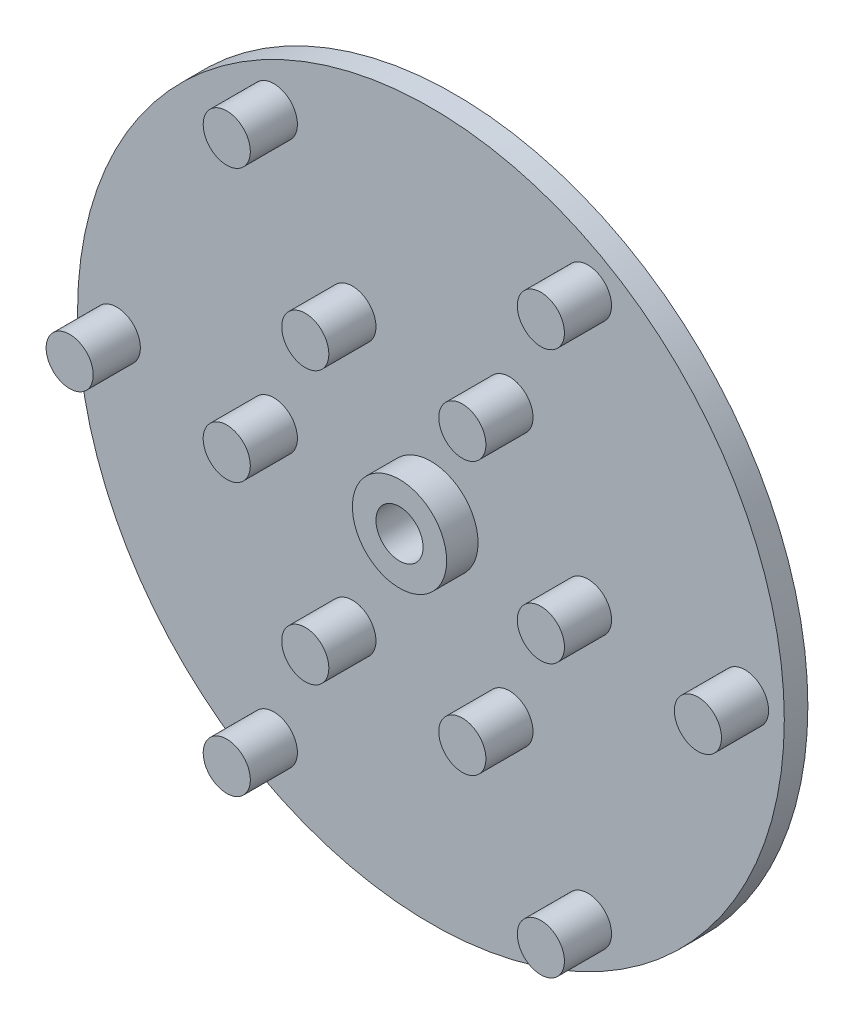
from build123d import *

# Parameters (mm, degrees)
SKETCH_1_R           = 45
EXTRUDE_1_DEPTH      = 3
SKETCH_2_R           = 3
EXTRUDE_2_DEPTH      = 6
EXTRUDE_3_DEPTH      = 4
EXTRUDE_3_DEPTH_BACK = 5
SKETCH_3_R           = 6
CUT_EXTRUDE_1_REACH  = 66.273
SKETCH_4_R           = 3
SKETCH_5_R           = 3
EXTRUDE_4_DEPTH      = 6


with BuildPart() as part:
    # 草图1 → 凸台-拉伸1 (new body)
    with BuildSketch(Plane.XY):
        Circle(SKETCH_1_R)
    extrude(amount=-EXTRUDE_1_DEPTH)

    # 草图2 → 凸台-拉伸2 (add)
    with BuildSketch(Plane.XY):
        with Locations(Location((-40, 0, 0), (0, 0, 180))):
            Circle(SKETCH_2_R)
        with Locations(Location((-20, 34.641016151, 0), (0, 0, 180))):
            Circle(SKETCH_2_R)
        with Locations(Location((20, 34.641016151, 0), (0, 0, 180))):
            Circle(SKETCH_2_R)
        with Locations(Location((40, 0, 0), (0, 0, 180))):
            Circle(SKETCH_2_R)
        with Locations(Location((20, -34.641016151, 0), (0, 0, 180))):
            Circle(SKETCH_2_R)
        with Locations(Location((-20, -34.641016151, 0), (0, 0, 180))):
            Circle(SKETCH_2_R)
    extrude(amount=EXTRUDE_2_DEPTH)

    # 草图3 → 凸台-拉伸3 (add, two sides: drawn at the far end of the back side and taken through both)
    with BuildSketch(Plane.XY.offset(-EXTRUDE_3_DEPTH_BACK)):
        Circle(SKETCH_3_R)
    extrude(amount=EXTRUDE_3_DEPTH + EXTRUDE_3_DEPTH_BACK)

    # 草图4 → 切除-拉伸1 (cut, up to next)
    with BuildSketch(Plane.XY.offset(4), mode=Mode.PRIVATE) as cut_extrude_1_sk1:
        Circle(SKETCH_4_R)
    cut_extrude_1_tool1 = extrude(cut_extrude_1_sk1.sketch, amount=-CUT_EXTRUDE_1_REACH, mode=Mode.PRIVATE) & part.part
    add(cut_extrude_1_tool1.solids().sort_by_distance((0, 0, 4))[0], mode=Mode.SUBTRACT)

    # 草图5 → 凸台-拉伸4 (add)
    with BuildSketch(Plane.XY):
        with Locations((-20, 0)):
            Circle(SKETCH_5_R)
        with Locations((-10, 17.320508076)):
            Circle(SKETCH_5_R)
        with Locations((10, 17.320508076)):
            Circle(SKETCH_5_R)
        with Locations((20, 0)):
            Circle(SKETCH_5_R)
        with Locations((10, -17.320508076)):
            Circle(SKETCH_5_R)
        with Locations((-10, -17.320508076)):
            Circle(SKETCH_5_R)
    extrude(amount=EXTRUDE_4_DEPTH)


solid = part.part
